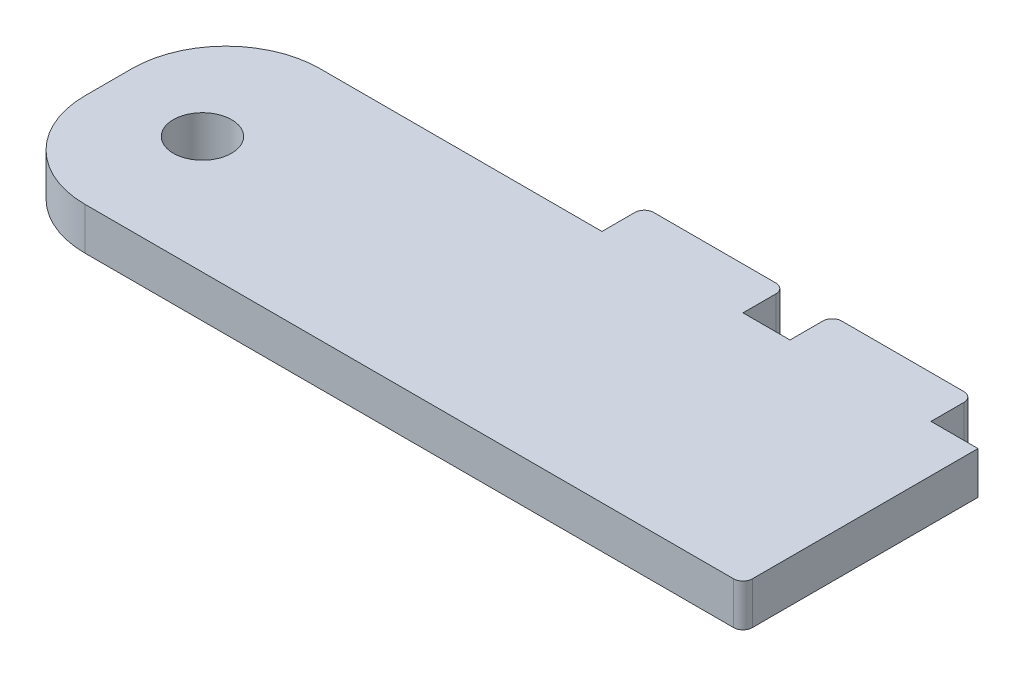
from build123d import *

# Parameters (mm, degrees)
SKETCH1_R           = 3.1
BOSS_EXTRUDE1_DEPTH = 4.5


with BuildPart() as part:
    # Sketch1 → Boss-Extrude1 (new body)
    with BuildSketch(Plane(origin=(0, 0, 0), x_dir=(1, 0, 0), z_dir=(0, 1, 0))):
        with BuildLine():
            Line((-30, -12.5), (39, -12.5))
            ThreePointArc((39, -12.5), (39.707106781, -12.207106781), (40, -11.5))
            Line((40, -11.5), (40, 12.5))
            Line((40, 12.5), (35, 12.5))
            Line((35, 12.5), (35, 16))
            ThreePointArc((35, 16), (34.707106781, 16.707106781), (34, 17))
            Line((34, 17), (21, 17))
            ThreePointArc((21, 17), (20.292893219, 16.707106781), (20, 16))
            Line((20, 16), (20, 12.5))
            Line((20, 12.5), (15, 12.5))
            Line((15, 12.5), (15, 16))
            ThreePointArc((15, 16), (14.707106781, 16.707106781), (14, 17))
            Line((14, 17), (1, 17))
            ThreePointArc((1, 17), (0.292893219, 16.707106781), (0, 16))
            Line((0, 16), (0, 12.5))
            Line((0, 12.5), (-30, 12.5))
            ThreePointArc((-30, 12.5), (-37.071067812, 9.571067812), (-40, 2.5))
            Line((-40, 2.5), (-40, -2.5))
            ThreePointArc((-40, -2.5), (-37.071067812, -9.571067812), (-30, -12.5))
        make_face()
        with Locations(Location((-30, 0, 0), (0, 0, 270))):
            Circle(SKETCH1_R, mode=Mode.SUBTRACT)
    extrude(amount=BOSS_EXTRUDE1_DEPTH)


solid = part.part
